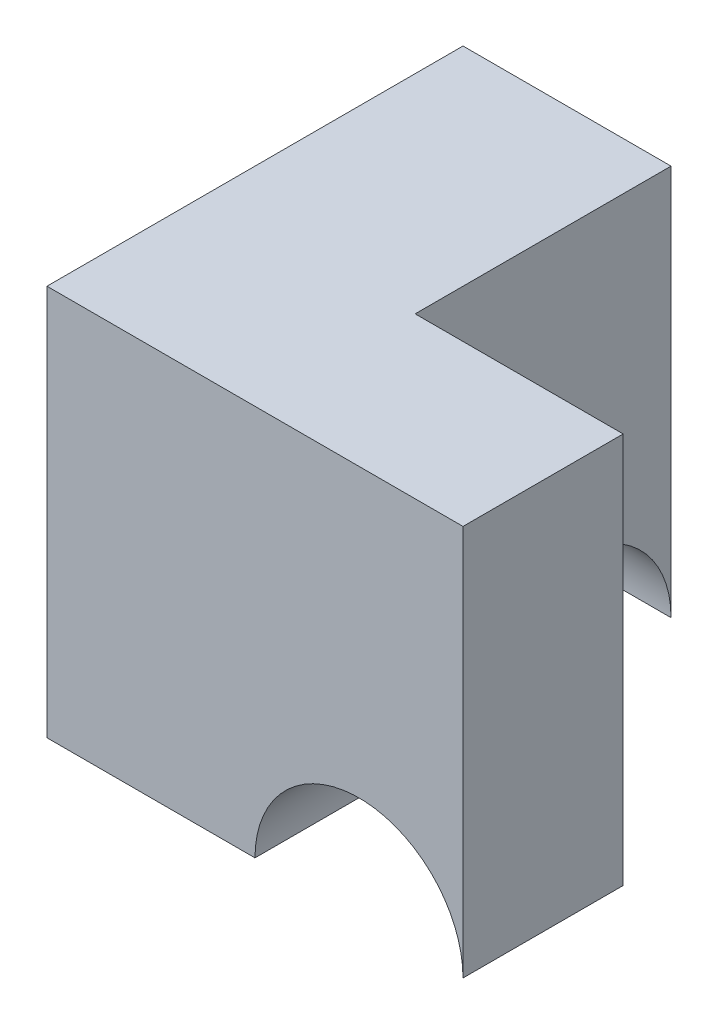
from build123d import *

# Parameters (mm, degrees)
SKETCH1_W               = 25
SKETCH1_H               = 19.246899001
BOSS_EXTRUDE1_DEPTH     = 47
CUT_EXTRUDE1_DEPTH      = 74.034238546
CUT_EXTRUDE1_DEPTH_BACK = 50
SKETCH3_R               = 12.5
CUT_EXTRUDE2_DEPTH      = 50


with BuildPart() as part:
    # Sketch1 → Boss-Extrude1 (new body)
    with BuildSketch(Plane(origin=(0, 0, 0), x_dir=(1, 0, 0), z_dir=(0, 1, 0))):
        Polygon((0, -19.246899001), (0, 0), (0, 30.753100999), (-25, 30.753100999), (-25, -19.246899001), align=None)
        with Locations((12.5, -9.623449501)):
            Rectangle(SKETCH1_W, SKETCH1_H)
    extrude(amount=BOSS_EXTRUDE1_DEPTH)

    # Sketch2 → Cut-Extrude1 (cut, two sides: drawn at the far end of the back side and taken through both)
    with BuildSketch(Plane.XY.offset(19.246899001).offset(-CUT_EXTRUDE1_DEPTH_BACK)):
        with BuildLine():
            Line((25, -147.244307714), (25, 0))
            ThreePointArc((25, 0), (12.5, 12.5), (0, 0))
            Line((0, 0), (0, -147.244307714))
            Line((0, -147.244307714), (0, -441.732923143))
            Line((0, -441.732923143), (25, -441.732923143))
            Line((25, -441.732923143), (25, -147.244307714))
        make_face()
    extrude(amount=CUT_EXTRUDE1_DEPTH + CUT_EXTRUDE1_DEPTH_BACK, mode=Mode.SUBTRACT)

    # Sketch3 → Cut-Extrude2 (cut)
    with BuildSketch(Plane.ZY.offset(25)):
        with Locations((-18.253100999, 0)):
            Circle(SKETCH3_R)
    extrude(amount=-CUT_EXTRUDE2_DEPTH, mode=Mode.SUBTRACT)


solid = part.part
